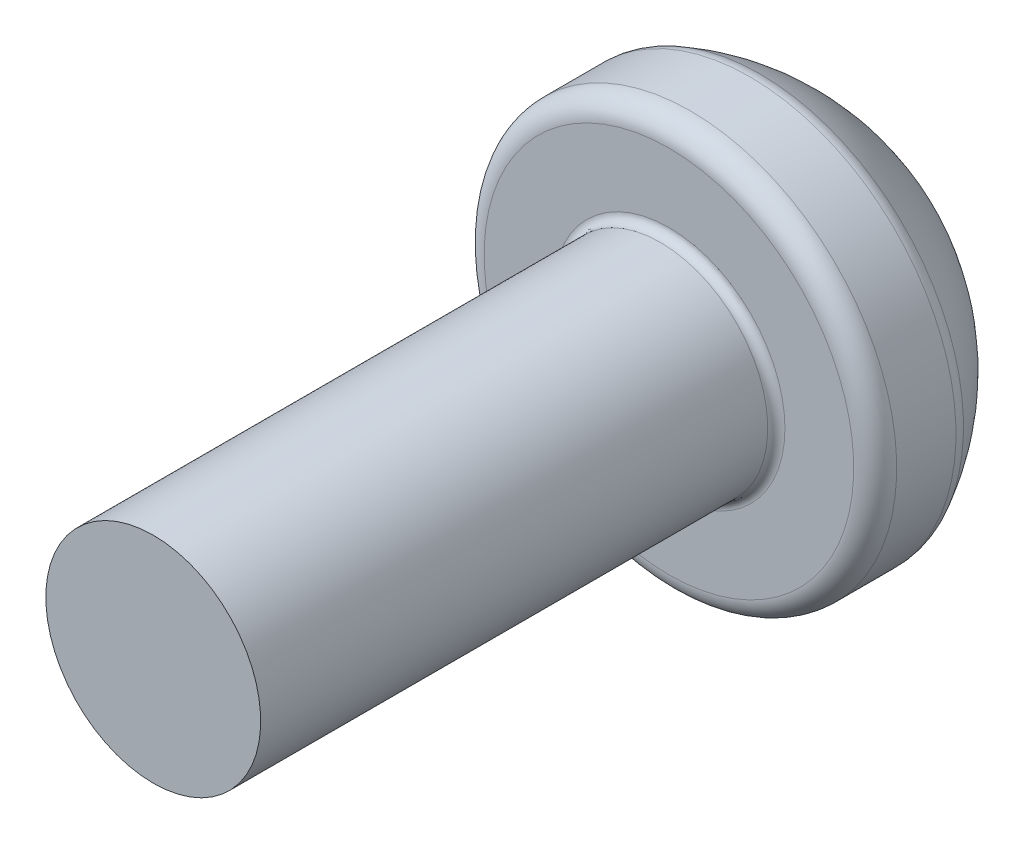
from build123d import *

# Parameters (mm, degrees)
FILLET1_R          = 0.1
FILLET2_R          = 0.25
HOLE1_D            = 2.05
HOLE1_DEPTH        = 1
HOLE1_TIP          = 0.37306949
CUT_EXTRUDE1_DEPTH = 1


with BuildPart() as part:
    # Sketch1 → Base-Revolve (revolve)
    with BuildSketch(Plane(origin=(0, 0, 0), x_dir=(0, 0, -1), z_dir=(1, 0, 0))):
        with BuildLine():
            Line((-6, 0), (-6, 1.25))
            Line((-6, 1.25), (0, 1.25))
            Line((0, 1.25), (0, 2.4))
            Line((0, 2.4), (1, 2.4))
            ThreePointArc((1, 2.4), (1.553716943, 2.032461562), (2, 1.54))
            Line((2, 1.54), (2, 0))
            Line((2, 0), (-6, 0))
        make_face()
    revolve(axis=Axis((0, 0, -2), (0, 0, 1)))

    # Fillet1
    fillet1_edges = [part.edges().sort_by_distance(p)[0] for p in [
        (0, -1.25, 0),
    ]]
    fillet(fillet1_edges, radius=FILLET1_R)

    # Fillet2
    fillet2_edges = [part.edges().sort_by_distance(p)[0] for p in [
        (0, -2.4, -1),
        (0, -2.4, 0),
    ]]
    fillet(fillet2_edges, radius=FILLET2_R)

    # Hole1
    with Locations(Plane(origin=(0, 0, -2), x_dir=(-1, 0, 0), z_dir=(0, 0, -1))):
        with Locations((0, 0)):
            Hole(HOLE1_D / 2, depth=HOLE1_DEPTH)
            with Locations((0, 0, -(HOLE1_DEPTH + HOLE1_TIP / 2))):  # 140° drill point
                Cone(0, HOLE1_D / 2, HOLE1_TIP, mode=Mode.SUBTRACT)

    # Sketch4 → Cut-Extrude1 (cut)
    with BuildSketch(Plane(origin=(0, 0, -2), x_dir=(-1, 0, 0), z_dir=(0, 0, -1))):
        with BuildLine():
            ThreePointArc((1.088832331, -0.880025088), (1.212435565, -0.7), (1.306540248, -0.502943915))
            ThreePointArc((1.306540248, -0.502943915), (1.025, 0), (1.306540248, 0.502943915))
            ThreePointArc((1.306540248, 0.502943915), (1.212435565, 0.7), (1.088832331, 0.880025088))
            ThreePointArc((1.088832331, 0.880025088), (0.5125, 0.887676039), (0.217707917, 1.382969003))
            ThreePointArc((0.217707917, 1.382969003), (0, 1.4), (-0.217707917, 1.382969003))
            ThreePointArc((-0.217707917, 1.382969003), (-0.5125, 0.887676039), (-1.088832331, 0.880025088))
            ThreePointArc((-1.088832331, 0.880025088), (-1.212435565, 0.7), (-1.306540248, 0.502943915))
            ThreePointArc((-1.306540248, 0.502943915), (-1.025, 0), (-1.306540248, -0.502943915))
            ThreePointArc((-1.306540248, -0.502943915), (-1.212435565, -0.7), (-1.088832331, -0.880025088))
            ThreePointArc((-1.088832331, -0.880025088), (-0.5125, -0.887676039), (-0.217707917, -1.382969003))
            ThreePointArc((-0.217707917, -1.382969003), (0, -1.4), (0.217707917, -1.382969003))
            ThreePointArc((0.217707917, -1.382969003), (0.5125, -0.887676039), (1.088832331, -0.880025088))
        make_face()
    extrude(amount=-CUT_EXTRUDE1_DEPTH, mode=Mode.SUBTRACT)


solid = part.part
